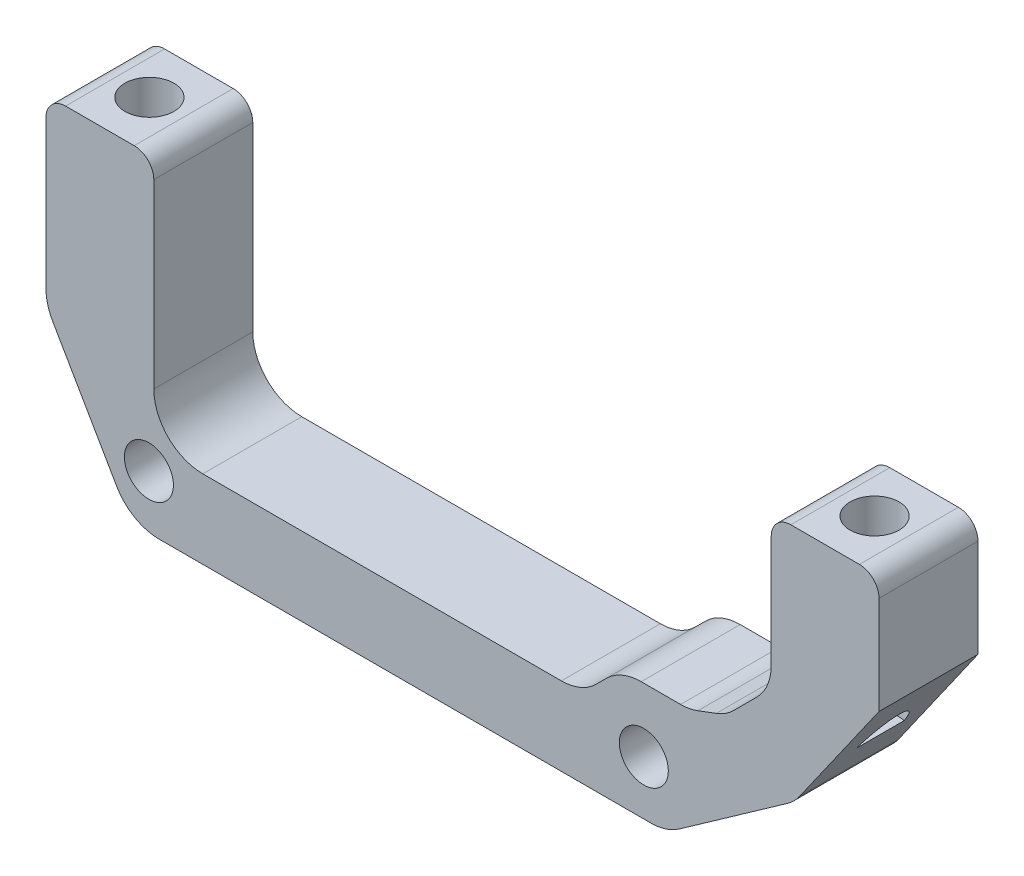
from build123d import *

# Parameters (mm, degrees)
BOSS_EXTRUDE1_DEPTH      = 5.05
BOSS_EXTRUDE1_DEPTH_BACK = 5.05
FILLET1_R                = 5
SKETCH2_R                = 2.5
CUT_EXTRUDE1_DEPTH       = 19
FILLET2_R                = 2
CUT_EXTRUDE2_DEPTH       = 46.959928198
CUT_EXTRUDE2_DEPTH_BACK  = 46.959928198
SKETCH3_R                = 2.5


with BuildPart() as part:
    # Sketch1 → Boss-Extrude1 (new, two sides: drawn at the far end of the back side and taken through both)
    with BuildSketch(Plane.XY.offset(-BOSS_EXTRUDE1_DEPTH_BACK)):
        Polygon((-31.5, 16.75), (-31.5, -8.75), (12.160254038, -8.75), (16.160254038, -4.75), (23.160254038, -4.75), (26.903805922, -3.340808995), (31.5, 1.255385083), (31.5, 16.75), (42.5, 16.75), (42.5, 4.75), (33.884592717, -7.529037314), (20.808895905, -16.75), (-33.839745962, -16.75), (-42.5, -1.75), (-42.5, 16.75), align=None)
    extrude(amount=BOSS_EXTRUDE1_DEPTH + BOSS_EXTRUDE1_DEPTH_BACK)

    # Fillet1
    fillet1_edges = [part.edges().sort_by_distance(p)[0] for p in [
        (31.5, 1.255385083, 0),
        (26.903805922, -3.340808995, 0),
        (23.160254038, -4.75, 0),
        (16.160254038, -4.75, 0),
        (12.160254038, -8.75, 0),
        (33.884592717, -7.529037314, 0),
        (20.808895905, -16.75, 0),
        (-33.839745962, -16.75, 0),
        (-42.5, -1.75, 0),
        (-31.5, -8.75, 0),
    ]]
    fillet(fillet1_edges, radius=FILLET1_R)

    # Sketch2 → Cut-Extrude1 (cut)
    with BuildSketch(Plane(origin=(0, 16.75, 0), x_dir=(1, 0, 0), z_dir=(0, 1, 0))):
        with Locations((-37, 0)):
            Circle(SKETCH2_R)
        with Locations((37, 0)):
            Circle(SKETCH2_R)
    extrude(amount=-CUT_EXTRUDE1_DEPTH, mode=Mode.SUBTRACT)

    # Fillet2
    fillet2_edges = [part.edges().sort_by_distance(p)[0] for p in [
        (42.5, 16.75, 0),
        (31.5, 16.75, 0),
        (-31.5, 16.75, 0),
        (-42.5, 16.75, 0),
    ]]
    fillet(fillet2_edges, radius=FILLET2_R)

    # Sketch3 → Cut-Extrude2 (cut, two sides: drawn at the far end of the back side and taken through both)
    with BuildSketch(Plane.XY.offset(-CUT_EXTRUDE2_DEPTH_BACK)):
        with Locations((-32, -11.25)):
            Circle(SKETCH3_R)
        with Locations((18.5, -11.25)):
            Circle(SKETCH3_R)
    extrude(amount=CUT_EXTRUDE2_DEPTH + CUT_EXTRUDE2_DEPTH_BACK, mode=Mode.SUBTRACT)


solid = part.part
